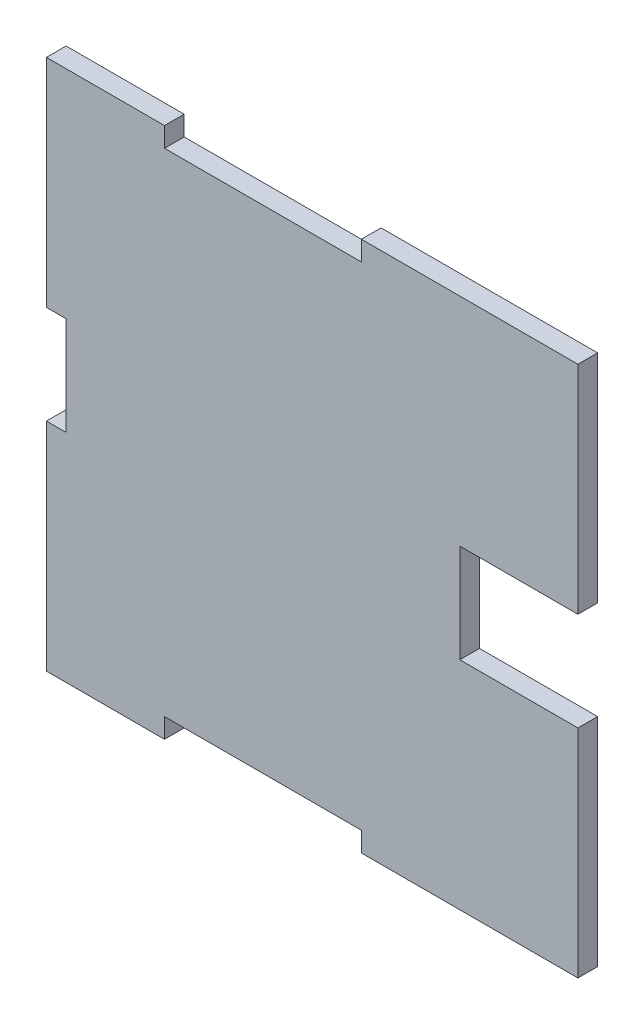
from build123d import *

# Parameters (mm, degrees)
SKETCH2_W           = 108
SKETCH2_H           = 108
BOSS_EXTRUDE1_DEPTH = 4
SKETCH3_W           = 20
SKETCH3_H           = 8
SKETCH3_W_2         = 8
SKETCH3_H_2         = 20
CUT_EXTRUDE1_DEPTH  = 4
SKETCH4_W           = 20
SKETCH4_H           = 4
SKETCH4_H_2         = 20
CUT_EXTRUDE2_DEPTH  = 4


with BuildPart() as part:
    # Sketch2 → Boss-Extrude1 (new body)
    with BuildSketch(Plane.XY):
        Rectangle(SKETCH2_W, SKETCH2_H)
    extrude(amount=BOSS_EXTRUDE1_DEPTH)

    # Sketch3 → Cut-Extrude1 (cut)
    with BuildSketch(Plane(origin=(0, 0, 0), x_dir=(-1, 0, 0), z_dir=(0, 0, -1))):
        with Locations((0, 54)):
            Rectangle(SKETCH3_W, SKETCH3_H)
        with Locations((54, 0)):
            Rectangle(SKETCH3_W_2, SKETCH3_H_2)
        with Locations((-54, 0)):
            Rectangle(SKETCH3_W_2, SKETCH3_H_2)
        with Locations((0, -54)):
            Rectangle(SKETCH3_W, SKETCH3_H)
    extrude(amount=-CUT_EXTRUDE1_DEPTH, mode=Mode.SUBTRACT)

    # Sketch4 → Cut-Extrude2 (cut)
    with BuildSketch(Plane(origin=(0, 0, 0), x_dir=(-1, 0, 0), z_dir=(0, 0, -1))):
        with Locations((20, 52)):
            Rectangle(SKETCH4_W, SKETCH4_H)
        with Locations((20, -52)):
            Rectangle(SKETCH4_W, SKETCH4_H)
        with Locations((-40, 0)):
            Rectangle(SKETCH4_W, SKETCH4_H_2)
    extrude(amount=-CUT_EXTRUDE2_DEPTH, mode=Mode.SUBTRACT)


solid = part.part
